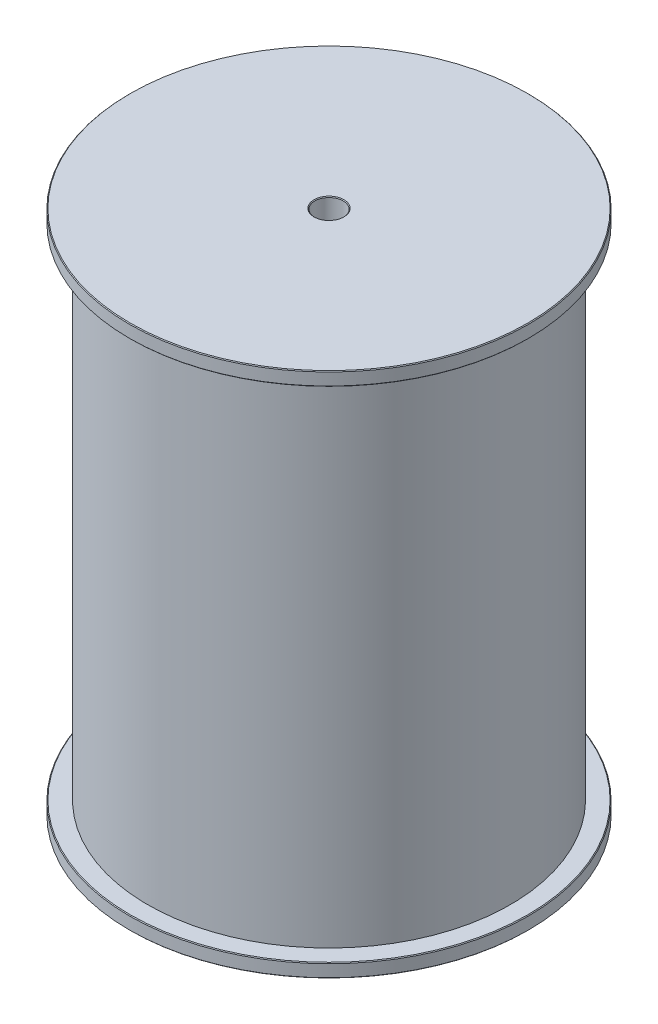
from build123d import *

# Parameters (mm, degrees)
CHAMFER1_SIZE = 0.127


with BuildPart() as part:
    # Sketch1 → Revolve1 (revolve)
    with BuildSketch(Plane.XY, mode=Mode.PRIVATE) as revolve1_sk:
        Polygon((2.4892, 4.7752), (2.4892, 0), (34.925, 0), (34.925, 2.38125), (31.75, 2.38125), (31.75, 89.69375), (34.925, 89.69375), (34.925, 92.075), (2.4892, 92.075), (2.4892, 46.0375), (2.4892, 36.4998), align=None)
    revolve(revolve1_sk.sketch.rotate(Axis((0, 92.075, 0), (0, -1, 0)), 180), axis=Axis((0, 92.075, 0), (0, -1, 0)))

    # Chamfer1
    chamfer1_edges = [part.edges().sort_by_distance(p)[0] for p in [
        (34.925, 2.38125, 0),
        (34.925, 0, 0),
        (2.4892, 0, 0),
        (2.4892, 92.075, 0),
        (34.925, 92.075, 0),
        (34.925, 89.69375, 0),
    ]]
    chamfer(chamfer1_edges, length=CHAMFER1_SIZE)


solid = part.part
